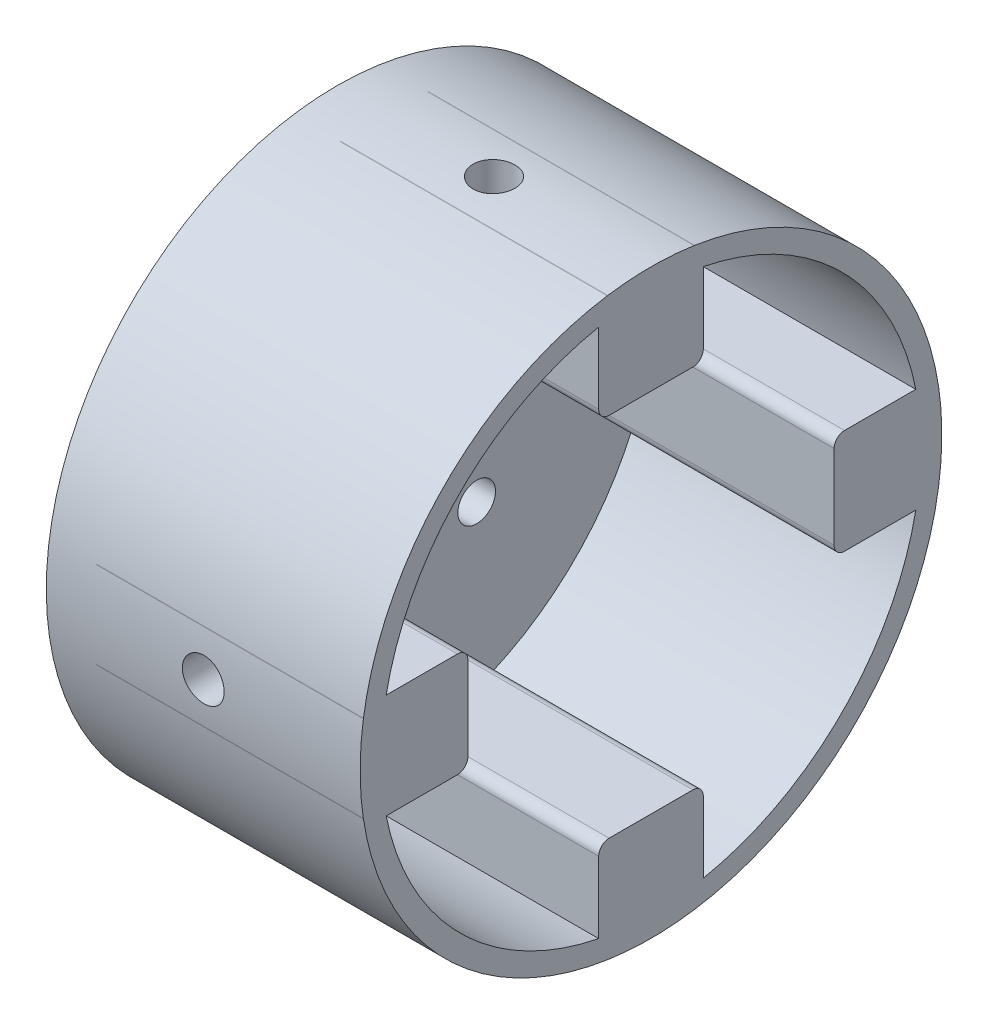
from build123d import *

# Parameters (mm, degrees)
BOSS_EXTRUDE1_DEPTH = 25.5
SKETCH3_R           = 1.8
CUT_EXTRUDE1_DEPTH  = 4.5
SKETCH4_R           = 4
CUT_EXTRUDE2_DEPTH  = 2
SKETCH5_W           = 6
SKETCH5_H           = 25
CUT_EXTRUDE3_DEPTH  = 2
SKETCH6_R           = 2
CUT_EXTRUDE4_DEPTH  = 7
CUT_EXTRUDE5_START  = 7
SKETCH7_R           = 2
CUT_EXTRUDE5_DEPTH  = 7
SKETCH8_R           = 2
CUT_EXTRUDE6_DEPTH  = 7
CUT_EXTRUDE7_START  = 7
SKETCH9_R           = 2
CUT_EXTRUDE7_DEPTH  = 7


with BuildPart() as part:
    # Sketch1 → Revolve1 (revolve)
    with BuildSketch(Plane.XY, mode=Mode.PRIVATE) as revolve1_sk:
        Polygon((0, 0), (0, 27.8), (30, 27.8), (30, 25.8), (4.5, 25.8), (4.5, 0), align=None)
    revolve(revolve1_sk.sketch.rotate(Axis((-10, 0, 0), (1, 0, 0)), 90), axis=Axis((-10, 0, 0), (1, 0, 0)))

    # Sketch2 → Boss-Extrude1 (add)
    with BuildSketch(Plane(origin=(4.5, 0, 0), x_dir=(0, 0, -1), z_dir=(1, 0, 0))):
        with BuildLine():
            Line((-4, 17.5), (4, 17.5))
            ThreePointArc((4, 17.5), (4.707106781, 17.792893219), (5, 18.5))
            Line((5, 18.5), (5, 26.5))
            ThreePointArc((5, 26.5), (4.707106781, 27.207106781), (4, 27.5))
            Line((4, 27.5), (-4, 27.5))
            ThreePointArc((-4, 27.5), (-4.707106781, 27.207106781), (-5, 26.5))
            Line((-5, 26.5), (-5, 18.5))
            ThreePointArc((-5, 18.5), (-4.707106781, 17.792893219), (-4, 17.5))
        make_face()
        with BuildLine():
            Line((-4, -27.5), (4, -27.5))
            ThreePointArc((4, -27.5), (4.707106781, -27.207106781), (5, -26.5))
            Line((5, -26.5), (5, -18.5))
            ThreePointArc((5, -18.5), (4.707106781, -17.792893219), (4, -17.5))
            Line((4, -17.5), (-4, -17.5))
            ThreePointArc((-4, -17.5), (-4.707106781, -17.792893219), (-5, -18.5))
            Line((-5, -18.5), (-5, -26.5))
            ThreePointArc((-5, -26.5), (-4.707106781, -27.207106781), (-4, -27.5))
        make_face()
        with BuildLine():
            Line((-26.5, -5), (-18.5, -5))
            ThreePointArc((-18.5, -5), (-17.792893219, -4.707106781), (-17.5, -4))
            Line((-17.5, -4), (-17.5, 4))
            ThreePointArc((-17.5, 4), (-17.792893219, 4.707106781), (-18.5, 5))
            Line((-18.5, 5), (-26.5, 5))
            ThreePointArc((-26.5, 5), (-27.207106781, 4.707106781), (-27.5, 4))
            Line((-27.5, 4), (-27.5, -4))
            ThreePointArc((-27.5, -4), (-27.207106781, -4.707106781), (-26.5, -5))
        make_face()
        with BuildLine():
            Line((18.5, -5), (26.5, -5))
            ThreePointArc((26.5, -5), (27.207106781, -4.707106781), (27.5, -4))
            Line((27.5, -4), (27.5, 4))
            ThreePointArc((27.5, 4), (27.207106781, 4.707106781), (26.5, 5))
            Line((26.5, 5), (18.5, 5))
            ThreePointArc((18.5, 5), (17.792893219, 4.707106781), (17.5, 4))
            Line((17.5, 4), (17.5, -4))
            ThreePointArc((17.5, -4), (17.792893219, -4.707106781), (18.5, -5))
        make_face()
    extrude(amount=BOSS_EXTRUDE1_DEPTH)

    # Sketch3 → Cut-Extrude1 (cut)
    with BuildSketch(Plane(origin=(0, 0, 0), x_dir=(0, 0, -1), z_dir=(1, 0, 0))):
        with Locations((-8.84, 8.84)):
            Circle(SKETCH3_R)
        with Locations((-8.84, -8.84)):
            Circle(SKETCH3_R)
        with Locations((8.84, 8.84)):
            Circle(SKETCH3_R)
        with Locations((8.84, -8.84)):
            Circle(SKETCH3_R)
    extrude(amount=CUT_EXTRUDE1_DEPTH, mode=Mode.SUBTRACT)

    # Sketch4 → Cut-Extrude2 (cut)
    with BuildSketch(Plane(origin=(0, 0, 0), x_dir=(0, 0, -1), z_dir=(1, 0, 0))):
        Circle(SKETCH4_R)
    extrude(amount=CUT_EXTRUDE2_DEPTH, mode=Mode.SUBTRACT)

    # Sketch5 → Cut-Extrude3 (cut)
    with BuildSketch(Plane(origin=(0, 0, 0), x_dir=(0, 0, -1), z_dir=(1, 0, 0))):
        with Locations((0, -15.5)):
            Rectangle(SKETCH5_W, SKETCH5_H)
    extrude(amount=CUT_EXTRUDE3_DEPTH, mode=Mode.SUBTRACT)

    # Sketch6 → Cut-Extrude4 (cut)
    with BuildSketch(Plane(origin=(0, 27.8, 0), x_dir=(1, 0, 0), z_dir=(0, 1, 0))):
        with Locations(Location((15, 0, 0), (0, 0, 270))):
            Circle(SKETCH6_R)
    extrude(amount=-CUT_EXTRUDE4_DEPTH, mode=Mode.SUBTRACT)

    # Sketch7 → Cut-Extrude5 (cut)
    with BuildSketch(Plane(origin=(0, -27.8, 0), x_dir=(1, 0, 0), z_dir=(0, 1, 0)).offset(CUT_EXTRUDE5_START)):
        with Locations(Location((15, 0, 0), (0, 0, 270))):
            Circle(SKETCH7_R)
    extrude(amount=-CUT_EXTRUDE5_DEPTH, mode=Mode.SUBTRACT)

    # Sketch8 → Cut-Extrude6 (cut)
    with BuildSketch(Plane.XY.offset(27.8)):
        with Locations((15, 0)):
            Circle(SKETCH8_R)
    extrude(amount=-CUT_EXTRUDE6_DEPTH, mode=Mode.SUBTRACT)

    # Sketch9 → Cut-Extrude7 (cut)
    with BuildSketch(Plane.XY.offset(-27.8).offset(CUT_EXTRUDE7_START)):
        with Locations((15, 0)):
            Circle(SKETCH9_R)
    extrude(amount=-CUT_EXTRUDE7_DEPTH, mode=Mode.SUBTRACT)


solid = part.part
